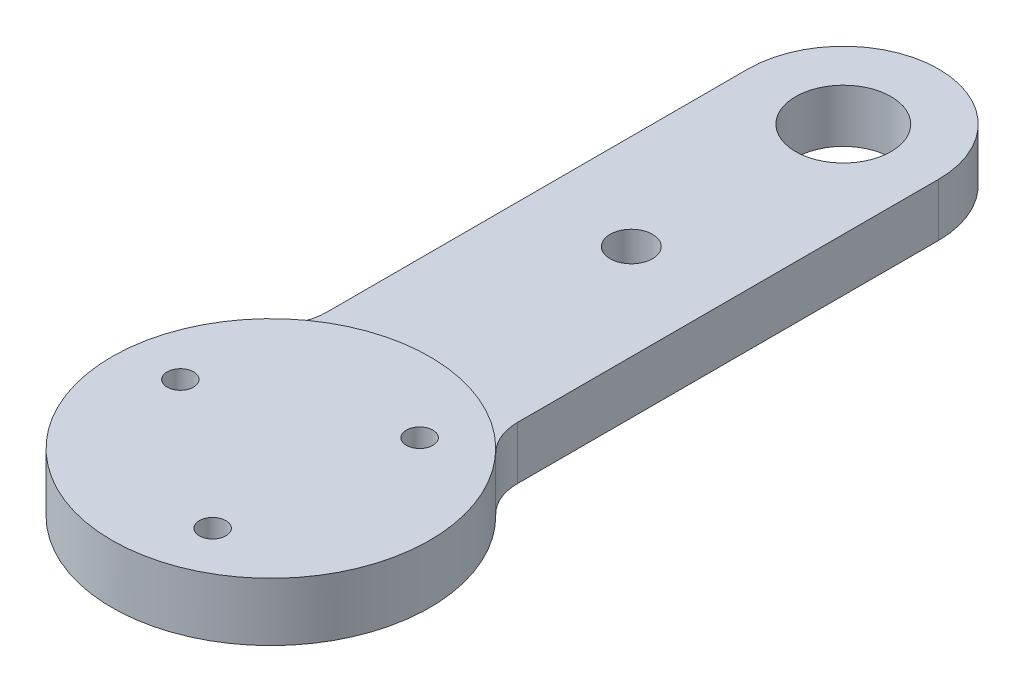
from build123d import *

# Parameters (mm, degrees)
SKETCH_1_R      = 4.5
SKETCH_1_R_2    = 2
SKETCH_1_R_3    = 1.25
EXTRUDE_2_DEPTH = 0.5
SKETCH_2_R      = 4.5
SKETCH_2_R_2    = 2
SKETCH_2_R_3    = 1.25
EXTRUDE_3_DEPTH = 4.5
SKETCH_3_R      = 15
SKETCH_3_R_2    = 1.25
EXTRUDE_4_DEPTH = 0.5


with BuildPart() as part:
    # 草图1 → 凸台-拉伸2 (new body)
    with BuildSketch(Plane(origin=(0, 0, 0), x_dir=(1, 0, 0), z_dir=(0, 1, 0))):
        with BuildLine():
            Line((-14.860465116, 23.546511628), (-14.860465116, -16.170631515))
            ThreePointArc((-14.860465116, -16.170631515), (-15.250692888, -18.107123188), (-16.360465116, -19.741345729))
            ThreePointArc((-16.360465116, -19.741345729), (-5.860465116, -45.453488372), (4.639534884, -19.741345729))
            ThreePointArc((4.639534884, -19.741345729), (3.529762655, -18.107123188), (3.139534884, -16.170631515))
            Line((3.139534884, -16.170631515), (3.139534884, 3.546511628))
            Line((3.139534884, 3.546511628), (3.139534884, 23.546511628))
            ThreePointArc((3.139534884, 23.546511628), (-5.860465116, 32.546511628), (-14.860465116, 23.546511628))
        make_face()
        with Locations(Location((-5.860465116, 23.546511628, 0), (0, 0, 270))):
            Circle(SKETCH_1_R, mode=Mode.SUBTRACT)
        with Locations(Location((-5.860465116, 3.546511628, 0), (0, 0, 270))):
            Circle(SKETCH_1_R_2, mode=Mode.SUBTRACT)
        with Locations(Location((-5.860465116, -30.453488372, 0), (0, 0, 270))):
            Circle(SKETCH_1_R, mode=Mode.SUBTRACT)
        with Locations(Location((-15.766516879, -29.085958307, 0), (0, 0, 270))):
            Circle(SKETCH_1_R_3, mode=Mode.SUBTRACT)
        with Locations(Location((-2.091755012, -39.716145882, 0), (0, 0, 270))):
            Circle(SKETCH_1_R_3, mode=Mode.SUBTRACT)
        with Locations(Location((0.276876542, -22.558360927, 0), (0, 0, 270))):
            Circle(SKETCH_1_R_3, mode=Mode.SUBTRACT)
    extrude(amount=EXTRUDE_2_DEPTH)

    # 草图2 → 凸台-拉伸3 (add)
    with BuildSketch(Plane(origin=(0, 0.5, 0), x_dir=(1, 0, 0), z_dir=(0, 1, 0))):
        with BuildLine():
            Line((-14.860465116, 23.546511628), (-14.860465116, -16.170631515))
            ThreePointArc((-14.860465116, -16.170631515), (-15.250692888, -18.107123188), (-16.360465116, -19.741345729))
            ThreePointArc((-16.360465116, -19.741345729), (-5.860465116, -45.453488372), (4.639534884, -19.741345729))
            ThreePointArc((4.639534884, -19.741345729), (3.529762655, -18.107123188), (3.139534884, -16.170631515))
            Line((3.139534884, -16.170631515), (3.139534884, 23.546511628))
            ThreePointArc((3.139534884, 23.546511628), (-5.860465116, 32.546511628), (-14.860465116, 23.546511628))
        make_face()
        with Locations(Location((-5.860465116, 23.546511628, 0), (0, 0, 270))):
            Circle(SKETCH_2_R, mode=Mode.SUBTRACT)
        with Locations(Location((-5.860465116, 3.546511628, 0), (0, 0, 270))):
            Circle(SKETCH_2_R_2, mode=Mode.SUBTRACT)
        with Locations(Location((-15.766516879, -29.085958307, 0), (0, 0, 270))):
            Circle(SKETCH_2_R_3, mode=Mode.SUBTRACT)
        with Locations(Location((-2.091755012, -39.716145882, 0), (0, 0, 270))):
            Circle(SKETCH_2_R_3, mode=Mode.SUBTRACT)
        with Locations(Location((0.276876542, -22.558360927, 0), (0, 0, 270))):
            Circle(SKETCH_2_R_3, mode=Mode.SUBTRACT)
    extrude(amount=EXTRUDE_3_DEPTH)

    # 草图3 → 凸台-拉伸4 (add)
    with BuildSketch(Plane(origin=(0, 5, 0), x_dir=(1, 0, 0), z_dir=(0, 1, 0))):
        with Locations(Location((-5.860465116, -30.453488372, 0), (0, 0, 45.572995999))):
            Circle(SKETCH_3_R)
        with Locations(Location((-15.766516879, -29.085958307, 0), (0, 0, 270))):
            Circle(SKETCH_3_R_2, mode=Mode.SUBTRACT)
        with Locations(Location((0.276876542, -22.558360927, 0), (0, 0, 270))):
            Circle(SKETCH_3_R_2, mode=Mode.SUBTRACT)
        with Locations(Location((-2.091755012, -39.716145882, 0), (0, 0, 270))):
            Circle(SKETCH_3_R_2, mode=Mode.SUBTRACT)
    extrude(amount=EXTRUDE_4_DEPTH)


solid = part.part
